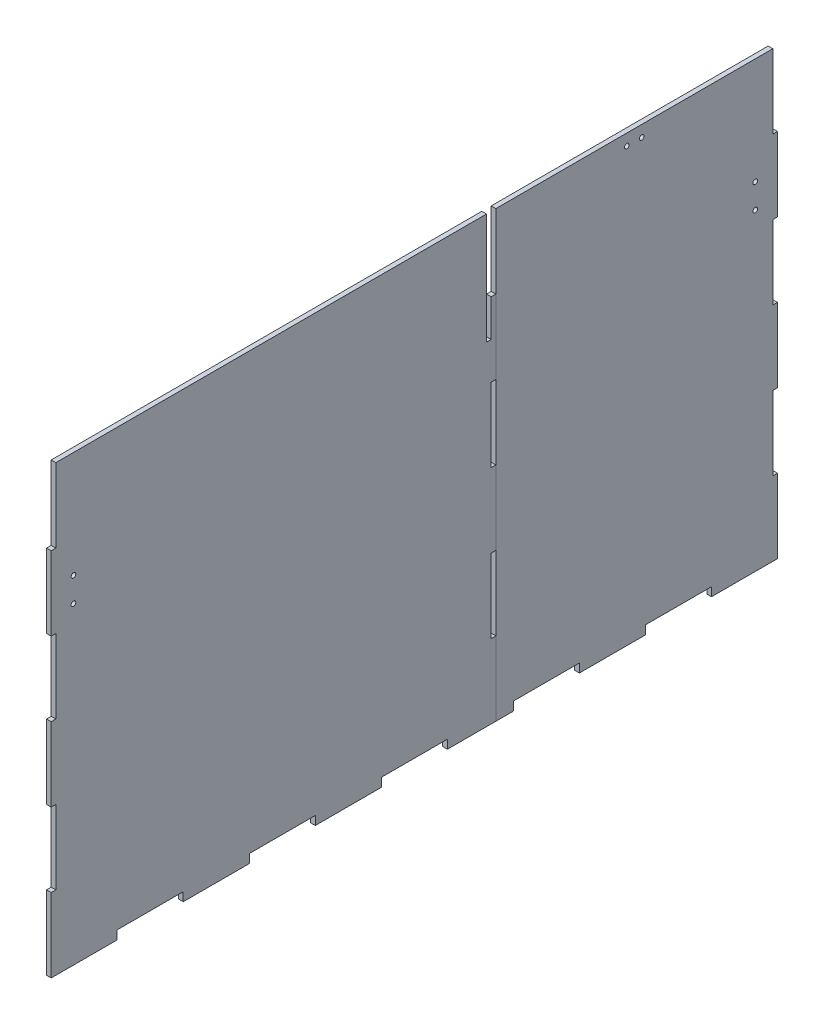
from build123d import *

# Parameters (mm, degrees)
BOSS_EXTRUDE1_DEPTH     = 1.4986
SKETCH1_3_W             = 11.272981818
SKETCH1_3_H             = 5.588
SKETCH1_3_W_2           = 42.381054545
SKETCH1_3_W_3           = 39.383854545
SKETCH1_3_W_4           = 2.9972
SKETCH1_3_H_2           = 41.91
SKETCH1_3_H_3           = 47.498
BOSS_EXTRUDE2_DEPTH     = 1.4986
SKETCH4_W               = 2.9972
SKETCH4_H               = 47.498
SKETCH4_H_2             = 23.749
CUT_EXTRUDE1_DEPTH      = 275.683887641
SKETCH9_R               = 1.5
CUT_EXTRUDE4_DEPTH      = 275.683887641
CUT_EXTRUDE5_DEPTH      = 275.671623441
CUT_EXTRUDE5_DEPTH_BACK = 275.671623441
SKETCH10_R              = 1.5
SPLIT1_SURFACE_1_BACK   = 547.408
SPLIT1_SURFACE_1_DEPTH  = 1094.816
SPLIT1_SURFACE_2_BACK   = 547.408
SPLIT1_SURFACE_2_DEPTH  = 1094.816


with BuildPart() as part:
    # Sketch1 → Boss-Extrude1 (new, symmetric)
    with BuildSketch(Plane(origin=(0, 0, 0), x_dir=(0, 0, -1), z_dir=(1, 0, 0))):
        Polygon((-230.0986, 139.7), (-230.0986, 92.202), (-233.0958, 92.202), (-233.0958, 44.704), (-230.0986, 44.704), (-230.0986, -2.794), (-233.0958, -2.794), (-233.0958, -50.292), (-230.0986, -50.292), (-230.0986, -97.79), (-233.0958, -97.79), (-233.0958, -145.288), (-190.714745455, -145.288), (-190.714745455, -139.7), (-148.333690909, -139.7), (-148.333690909, -145.288), (-105.952636364, -145.288), (-105.952636364, -139.7), (-63.571581818, -139.7), (-63.571581818, -145.288), (-21.190527273, -145.288), (-21.190527273, -139.7), (21.190527273, -139.7), (21.190527273, -145.288), (52.2986, -145.288), (52.2986, 139.7), align=None)
    extrude(amount=BOSS_EXTRUDE1_DEPTH, both=True)

    # Sketch1<3> → Boss-Extrude2 (add, symmetric)
    with BuildSketch(Plane(origin=(0, 0, 0), x_dir=(0, 0, -1), z_dir=(1, 0, 0))):
        Polygon((230.0986, 139.7), (52.2986, 139.7), (52.2986, -139.7), (63.571581818, -139.7), (105.952636364, -139.7), (148.333690909, -139.7), (190.714745455, -139.7), (230.0986, -139.7), (230.0986, -97.79), (230.0986, -50.292), (230.0986, -2.794), (230.0986, 44.704), (230.0986, 92.202), align=None)
        with Locations((57.935090909, -142.494)):
            Rectangle(SKETCH1_3_W, SKETCH1_3_H)
        with Locations((127.143163637, -142.494)):
            Rectangle(SKETCH1_3_W_2, SKETCH1_3_H)
        with Locations((210.406672727, -142.494)):
            Rectangle(SKETCH1_3_W_3, SKETCH1_3_H)
        with Locations((231.5972, -142.494)):
            Rectangle(SKETCH1_3_W_4, SKETCH1_3_H)
        with Locations((231.5972, -118.745)):
            Rectangle(SKETCH1_3_W_4, SKETCH1_3_H_2)
        with Locations((231.5972, -26.543)):
            Rectangle(SKETCH1_3_W_4, SKETCH1_3_H_3)
        with Locations((231.5972, 68.453)):
            Rectangle(SKETCH1_3_W_4, SKETCH1_3_H_3)
    extrude(amount=BOSS_EXTRUDE2_DEPTH, both=True)

    # Sketch4 → Cut-Extrude1 (cut, through all)
    with BuildSketch(Plane(origin=(1.4986, 0, 0), x_dir=(0, 0, -1), z_dir=(1, 0, 0))):
        with Locations((50.8, 20.955)):
            Rectangle(SKETCH4_W, SKETCH4_H)
        with Locations((50.8, -74.041)):
            Rectangle(SKETCH4_W, SKETCH4_H)
        with Locations((50.8, 115.951)):
            Rectangle(SKETCH4_W, SKETCH4_H)
        with Locations((47.8028, 115.951)):
            Rectangle(SKETCH4_W, SKETCH4_H)
        with Locations((47.8028, 80.3275)):
            Rectangle(SKETCH4_W, SKETCH4_H_2)
    extrude(amount=-CUT_EXTRUDE1_DEPTH, mode=Mode.SUBTRACT)

    # Sketch9 → Cut-Extrude4 (cut, through all)
    with BuildSketch(Plane(origin=(1.4986, 0, 0), x_dir=(0, 0, -1), z_dir=(1, 0, 0))):
        with Locations((-218.8083, 71.374)):
            Circle(SKETCH9_R)
        with Locations((-218.8083, 55.626)):
            Circle(SKETCH9_R)
        with Locations((218.8083, 71.374)):
            Circle(SKETCH9_R)
        with Locations((218.8083, 55.626)):
            Circle(SKETCH9_R)
    extrude(amount=-CUT_EXTRUDE4_DEPTH, mode=Mode.SUBTRACT)

    # Sketch10 → Cut-Extrude5 (cut, two sides: drawn at the far end of the back side and taken through both)
    with BuildSketch(Plane(origin=(0, 0, 0), x_dir=(0, 0, -1), z_dir=(1, 0, 0)).offset(-CUT_EXTRUDE5_DEPTH_BACK)):
        with Locations((145.9611, 132.3975)):
            Circle(SKETCH10_R)
        with Locations((136.4361, 132.3975)):
            Circle(SKETCH10_R)
    extrude(amount=CUT_EXTRUDE5_DEPTH + CUT_EXTRUDE5_DEPTH_BACK, mode=Mode.SUBTRACT)


with BuildPart() as body_2:
    # Split1: the piece behind the surface
    add(part.part)
    # Split1 surface: a surface, the sketch's curves swept straight by 1094.816 mm
    with BuildLine(Plane(origin=(1.4986, 0, 0), x_dir=(0, 0, -1), z_dir=(1, 0, 0)).offset(-SPLIT1_SURFACE_1_BACK), mode=Mode.PRIVATE) as split1_surface_1_path:
        Line((52.2986, 139.7), (52.2986, -145.288))
    split1_surface_1 = Shell.extrude(split1_surface_1_path.wire(), (1 * SPLIT1_SURFACE_1_DEPTH, 0 * SPLIT1_SURFACE_1_DEPTH, 0 * SPLIT1_SURFACE_1_DEPTH))
    split(bisect_by=split1_surface_1, keep=Keep.BOTTOM)


with BuildPart() as part_1:
    add(part.part)

    # Split1: split by a surface, the side it looks to stays
    # Split1 surface: a surface, the sketch's curves swept straight by 1094.816 mm
    with BuildLine(Plane(origin=(1.4986, 0, 0), x_dir=(0, 0, -1), z_dir=(1, 0, 0)).offset(-SPLIT1_SURFACE_2_BACK), mode=Mode.PRIVATE) as split1_surface_2_path:
        Line((52.2986, 139.7), (52.2986, -145.288))
    split1_surface_2 = Shell.extrude(split1_surface_2_path.wire(), (1 * SPLIT1_SURFACE_2_DEPTH, 0 * SPLIT1_SURFACE_2_DEPTH, 0 * SPLIT1_SURFACE_2_DEPTH))
    split(bisect_by=split1_surface_2, keep=Keep.TOP)


solid = Compound([body_2.part, part_1.part])
